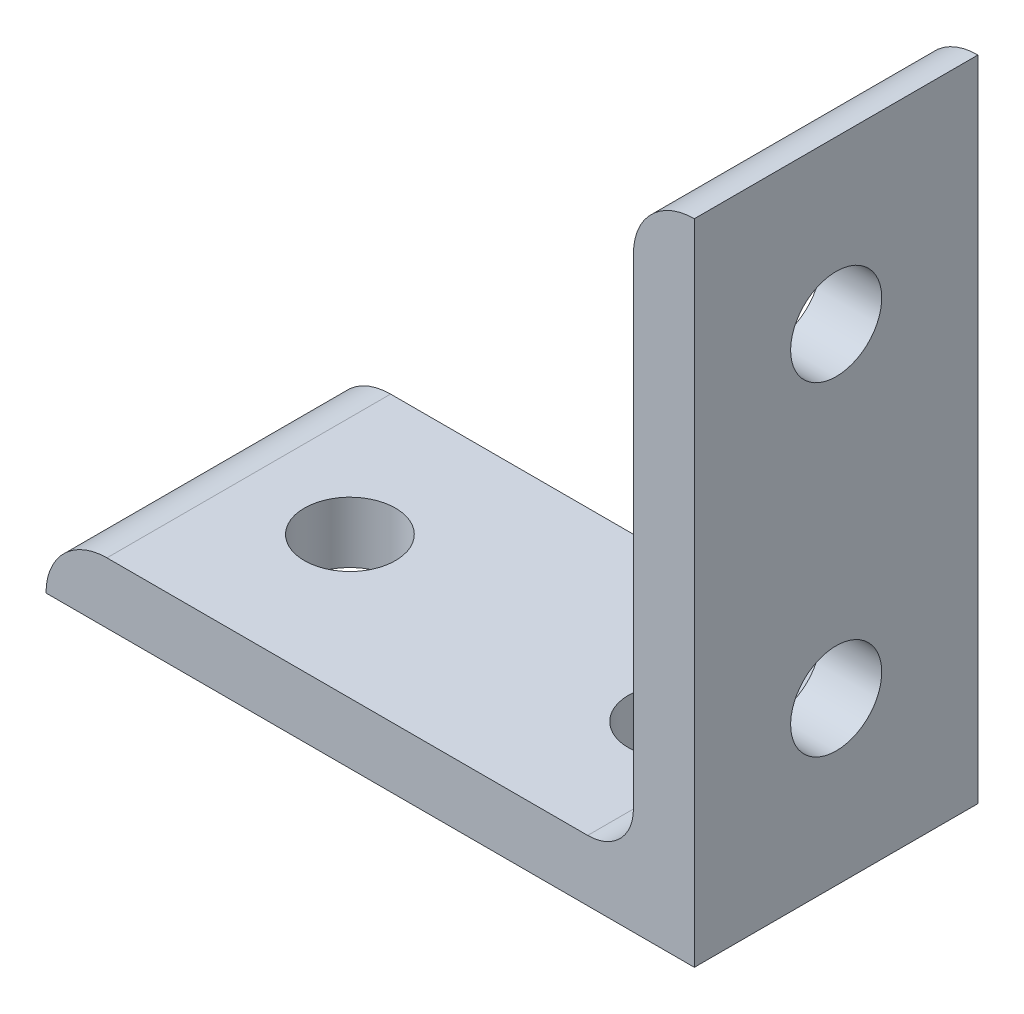
from build123d import *

# Parameters (mm, degrees)
EXTRUDE1_DEPTH     = 11.1125
SKETCH4_R          = 3.5687
CUT_EXTRUDE3_DEPTH = 70.44357329
SKETCH5_R          = 3.5687
CUT_EXTRUDE4_DEPTH = 70.44357329


with BuildPart() as part:
    # Sketch1 → Extrude1 (new, symmetric)
    with BuildSketch(Plane.XY):
        with BuildLine():
            Line((0, 0), (0, 50.8))
            ThreePointArc((0, 50.8), (-3.376576302, 49.401376302), (-4.7752, 46.0248))
            Line((-4.7752, 46.0248), (-4.7752, 8.3566))
            ThreePointArc((-4.7752, 8.3566), (-5.824167774, 5.824167774), (-8.3566, 4.7752))
            Line((-8.3566, 4.7752), (-46.0248, 4.7752))
            ThreePointArc((-46.0248, 4.7752), (-49.401376302, 3.376576302), (-50.8, 0))
            Line((-50.8, 0), (0, 0))
        make_face()
    extrude(amount=EXTRUDE1_DEPTH, both=True)

    # Sketch4 → Cut-Extrude3 (cut, through all)
    with BuildSketch(Plane(origin=(0, 4.7752, 0), x_dir=(1, 0, 0), z_dir=(0, 1, 0))):
        with Locations(Location((-12.7, 0, 0), (0, 0, 180))):
            Circle(SKETCH4_R)
        with Locations(Location((-38.1, 0, 0), (0, 0, 180))):
            Circle(SKETCH4_R)
    extrude(amount=-CUT_EXTRUDE3_DEPTH, mode=Mode.SUBTRACT)

    # Sketch5 → Cut-Extrude4 (cut, through all)
    with BuildSketch(Plane.ZY.offset(4.7752)):
        with Locations(Location((0, 38.1, 0), (0, 0, 270))):
            Circle(SKETCH5_R)
        with Locations(Location((0, 12.7, 0), (0, 0, 270))):
            Circle(SKETCH5_R)
    extrude(amount=-CUT_EXTRUDE4_DEPTH, mode=Mode.SUBTRACT)


solid = part.part
